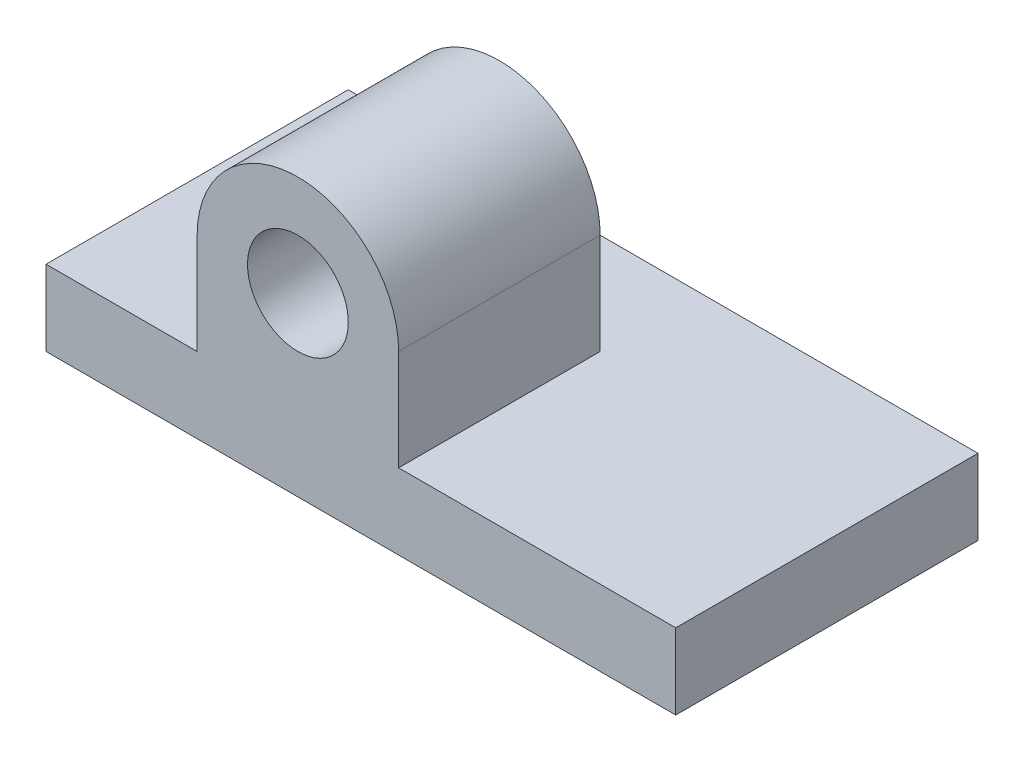
from build123d import *

# Parameters (mm, degrees)
BOSS_EXTRUDE1_DEPTH = 60
BOSS_EXTRUDE2_START = -40
SKETCH1_3_R         = 10
BOSS_EXTRUDE2_DEPTH = 40


with BuildPart() as part:
    # Sketch1 → Boss-Extrude1 (new body)
    with BuildSketch(Plane.XY):
        Polygon((0, 15), (0, 0), (50, 0), (125, 0), (125, 15), (70, 15), (50, 15), (30, 15), align=None)
    extrude(amount=-BOSS_EXTRUDE1_DEPTH)

    # Sketch1<3> → Boss-Extrude2 (add)
    with BuildSketch(Plane.XY.offset(BOSS_EXTRUDE2_START)):
        with BuildLine():
            Line((30, 35), (30, 15))
            Line((30, 15), (50, 15))
            Line((50, 15), (70, 15))
            Line((70, 15), (70, 35))
            ThreePointArc((70, 35), (50, 55), (30, 35))
        make_face()
        with Locations((50, 35)):
            Circle(SKETCH1_3_R, mode=Mode.SUBTRACT)
    extrude(amount=BOSS_EXTRUDE2_DEPTH)


solid = part.part
